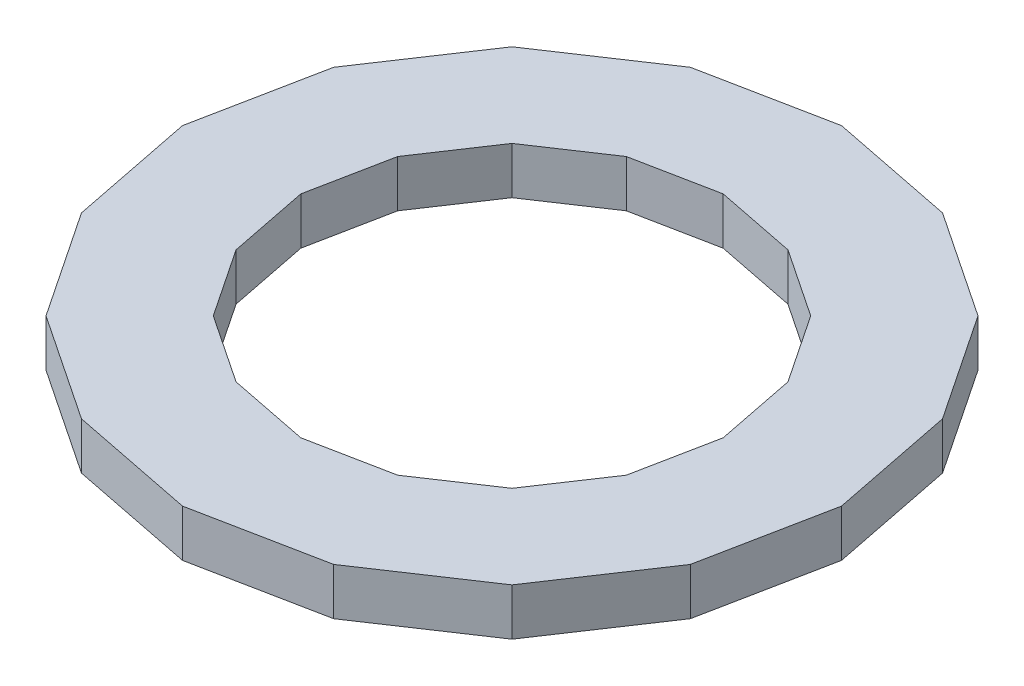
from build123d import *

# Parameters (mm, degrees)
BOSS_EXTRUDE1_DEPTH = 19.05


with BuildPart() as part:
    # Sketch1 → Boss-Extrude1 (new body)
    with BuildSketch(Plane(origin=(0, 0, 0), x_dir=(1, 0, 0), z_dir=(0, 1, 0))):
        Polygon((133.451007364, 0), (123.292654297, 51.069489551), (94.364112263, 94.364112263), (51.069489551, 123.292654297), (0, 133.451007364), (-51.069489551, 123.292654297), (-94.364112263, 94.364112263), (-123.292654297, 51.069489551), (-133.451007364, 0), (-123.292654297, -51.069489551), (-94.364112263, -94.364112263), (-51.069489551, -123.292654297), (0, -133.451007364), (51.069489551, -123.292654297), (94.364112263, -94.364112263), (123.292654297, -51.069489551), align=None)
        Polygon((85.54041884, 0), (79.029042168, 32.734901088), (60.486210227, 60.486210227), (32.734901088, 79.029042168), (0, 85.54041884), (-32.734901088, 79.029042168), (-60.486210227, 60.486210227), (-79.029042168, 32.734901088), (-85.54041884, 0), (-79.029042168, -32.734901088), (-60.486210227, -60.486210227), (-32.734901088, -79.029042168), (0, -85.54041884), (32.734901088, -79.029042168), (60.486210227, -60.486210227), (79.029042168, -32.734901088), align=None, mode=Mode.SUBTRACT)
    extrude(amount=BOSS_EXTRUDE1_DEPTH)


solid = part.part
